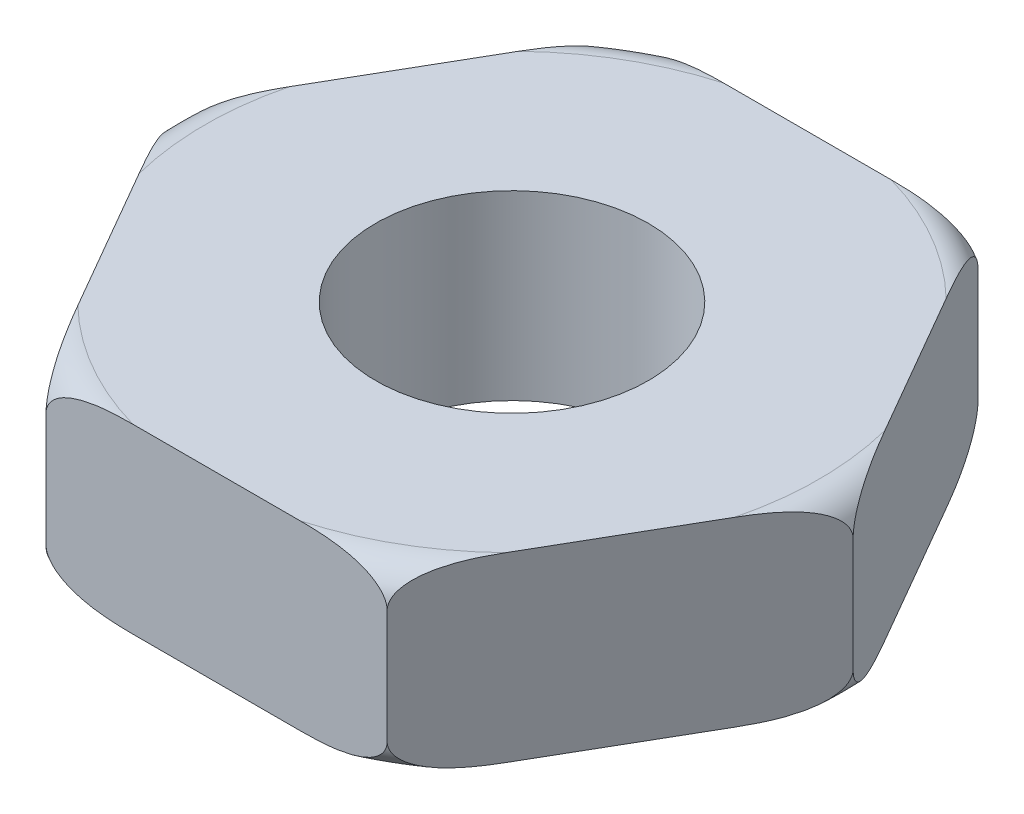
from build123d import *

# Parameters (mm, degrees)
BOSS_EXTRUDE1_DEPTH    = 8
F_12_0MM_DOWEL_HOLE1_D = 12


with BuildPart() as part:
    # Sketch1 → Boss-Extrude1 (new body)
    with BuildSketch(Plane(origin=(0, 0, 0), x_dir=(1, 0, 0), z_dir=(0, 1, 0))):
        Polygon((7.505553499, 13), (-7.505553499, 13), (-15.011106999, 0), (-7.505553499, -13), (7.505553499, -13), (15.011106999, 0), align=None)
    extrude(amount=BOSS_EXTRUDE1_DEPTH)

    # Ø12.0mm Dowel Hole1 (through all)
    with Locations(Plane(origin=(0, 0, 0), x_dir=(-1, 0, 0), z_dir=(0, -1, 0))):
        with Locations((0, 0)):
            Hole(F_12_0MM_DOWEL_HOLE1_D / 2)

    # Sketch4 → Cut-Revolve2 (revolve, cut)
    with BuildSketch(Plane.XY, mode=Mode.PRIVATE) as cut_revolve2_sk:
        with BuildLine():
            Line((20.381381373, -9.532480394), (20.381381373, 1.5))
            Line((20.381381373, 1.5), (15.011106999, 1.5))
            ThreePointArc((15.011106999, 1.5), (14.571767171, 0.439339828), (13.511106999, 0))
            Line((13.511106999, 0), (13.511106999, -9.532480394))
            Line((13.511106999, -9.532480394), (20.381381373, -9.532480394))
        make_face()
    cut_revolve2 = revolve(cut_revolve2_sk.sketch.rotate(Axis((0, 14.406395282, 0), (0, -1, 0)), 270), axis=Axis((0, 14.406395282, 0), (0, -1, 0)), mode=Mode.SUBTRACT)

    # Mirror1: Cut-Revolve2 across plane
    add(cut_revolve2.mirror(Plane(origin=(0, 4, 0), x_dir=(0, 0, 1), z_dir=(0, -1, 0))), mode=Mode.SUBTRACT)


solid = part.part
